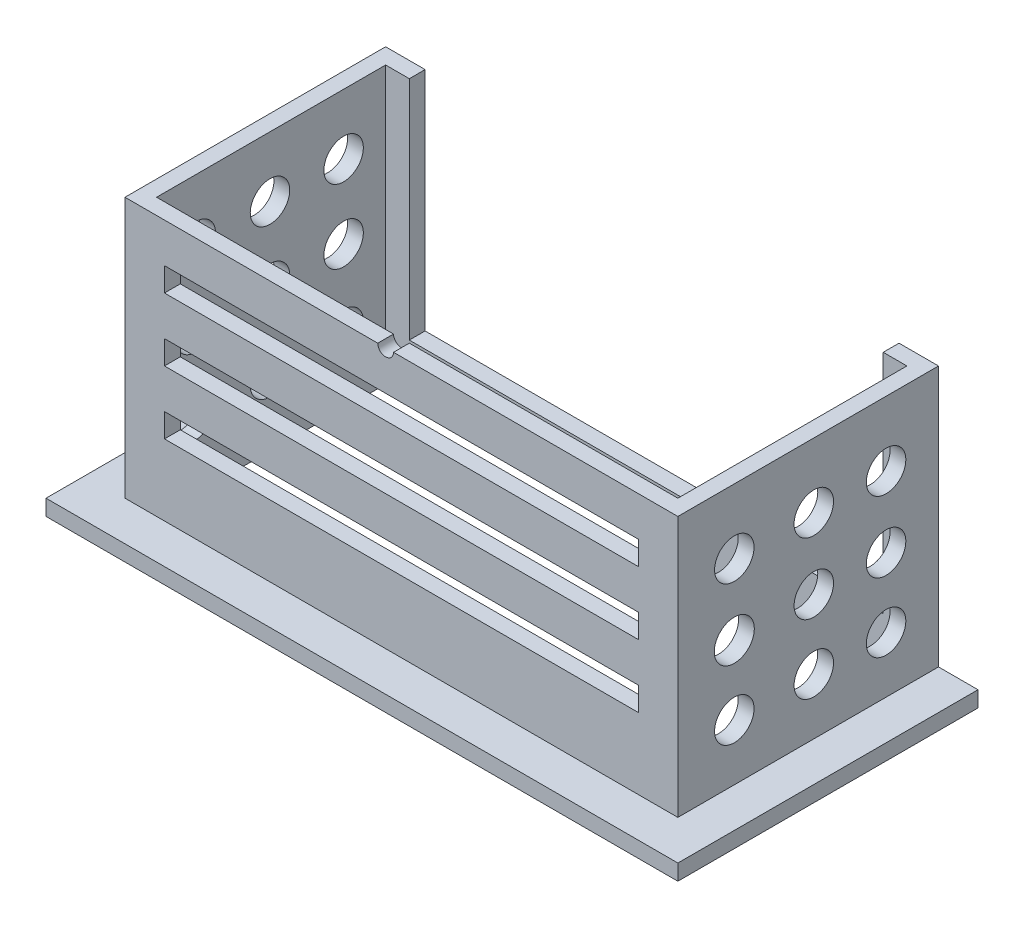
from build123d import *

# Parameters (mm, degrees)
SKETCH1_W           = 70
SKETCH1_H           = 33
BOSS_EXTRUDE1_DEPTH = 35
SKETCH2_W           = 33
SKETCH2_H           = 2
BOSS_EXTRUDE2_DEPTH = 5
SKETCH3_W           = 66
SKETCH3_H           = 29
CUT_EXTRUDE1_DEPTH  = 81.917773835
CUT_EXTRUDE3_DEPTH  = 5
SKETCH13_R          = 2.5
SKETCH13_R_2        = 2.535133393
CUT_EXTRUDE4_DEPTH  = 5
SKETCH14_W          = 33
SKETCH14_H          = 2
BOSS_EXTRUDE4_DEPTH = 5
SKETCH15_R          = 2.5
CUT_EXTRUDE5_DEPTH  = 5
SKETCH17_W          = 80
SKETCH17_H          = 2
BOSS_EXTRUDE6_DEPTH = 5
SKETCH19_W          = 60
SKETCH19_H          = 28.661725901
CUT_EXTRUDE6_DEPTH  = 5
SKETCH20_W          = 60
SKETCH20_H          = 3
CUT_EXTRUDE7_DEPTH  = 5
SKETCH21_W          = 60
SKETCH21_H          = 3
CUT_EXTRUDE8_DEPTH  = 5


with BuildPart() as part:
    # Sketch1 → Boss-Extrude1 (new body)
    with BuildSketch(Plane(origin=(0, 0, 0), x_dir=(1, 0, 0), z_dir=(0, 1, 0))):
        with Locations((-26.152195741, 23.288127357)):
            Rectangle(SKETCH1_W, SKETCH1_H)
    extrude(amount=BOSS_EXTRUDE1_DEPTH)

    # Sketch2 → Boss-Extrude2 (add)
    with BuildSketch(Plane(origin=(8.847804259, 0, 0), x_dir=(0, 0, -1), z_dir=(1, 0, 0))):
        with Locations((23.288127357, 1)):
            Rectangle(SKETCH2_W, SKETCH2_H)
    extrude(amount=BOSS_EXTRUDE2_DEPTH)

    # Sketch3 → Cut-Extrude1 (cut, through all)
    with BuildSketch(Plane(origin=(0, 35, 0), x_dir=(-1, 0, 0), z_dir=(0, 1, 0))):
        with Locations((26.152195741, -23.288127357)):
            Rectangle(SKETCH3_W, SKETCH3_H)
    extrude(amount=-CUT_EXTRUDE1_DEPTH, mode=Mode.SUBTRACT)

    # Sketch9 → Cut-Extrude3 (cut)
    with BuildSketch(Plane.XY.offset(-6.788127357)):
        with BuildLine():
            Line((-27.152195741, 35), (-28.152195741, 35))
            Line((-28.152195741, 35), (-29.152195741, 35))
            ThreePointArc((-29.152195741, 35), (-28.152195741, 34), (-27.152195741, 35))
        make_face()
    extrude(amount=-CUT_EXTRUDE3_DEPTH, mode=Mode.SUBTRACT)

    # Sketch13 → Cut-Extrude4 (cut)
    with BuildSketch(Plane(origin=(8.847804259, 0, 0), x_dir=(0, 0, -1), z_dir=(1, 0, 0))):
        with Locations((13.933834133, 9.111651729)):
            Circle(SKETCH13_R)
        with Locations((13.933834133, 17.855882351)):
            Circle(SKETCH13_R_2)
        with Locations((13.933834133, 26.803467174)):
            Circle(SKETCH13_R)
        with Locations((23.999867059, 26.803467174)):
            Circle(SKETCH13_R)
        with Locations((23.999867059, 17.855882351)):
            Circle(SKETCH13_R)
        with Locations((23.999867059, 9.111651729)):
            Circle(SKETCH13_R)
        with Locations((33.150806082, 9.111651729)):
            Circle(SKETCH13_R)
        with Locations((33.150806082, 17.855882351)):
            Circle(SKETCH13_R)
        with Locations((33.150806082, 26.803467174)):
            Circle(SKETCH13_R)
    extrude(amount=-CUT_EXTRUDE4_DEPTH, mode=Mode.SUBTRACT)

    # Sketch14 → Boss-Extrude4 (add)
    with BuildSketch(Plane.ZY.offset(61.152195741)):
        with Locations((-23.288127357, 1)):
            Rectangle(SKETCH14_W, SKETCH14_H)
    extrude(amount=BOSS_EXTRUDE4_DEPTH)

    # Sketch15 → Cut-Extrude5 (cut)
    with BuildSketch(Plane.ZY.offset(61.152195741)):
        with Locations((-32.467310019, 8.356134386)):
            Circle(SKETCH15_R)
        with Locations((-23.146909162, 8.426743484)):
            Circle(SKETCH15_R)
        with Locations((-13.755899208, 8.426743484)):
            Circle(SKETCH15_R)
        with Locations((-13.755899208, 18.029580731)):
            Circle(SKETCH15_R)
        with Locations((-23.146909162, 18.029580731)):
            Circle(SKETCH15_R)
        with Locations((-32.467310019, 18.029580731)):
            Circle(SKETCH15_R)
        with Locations((-32.467310019, 27.349981588)):
            Circle(SKETCH15_R)
        with Locations((-23.146909162, 27.349981588)):
            Circle(SKETCH15_R)
        with Locations((-13.755899208, 27.349981588)):
            Circle(SKETCH15_R)
    extrude(amount=-CUT_EXTRUDE5_DEPTH, mode=Mode.SUBTRACT)

    # Sketch17 → Boss-Extrude6 (add)
    with BuildSketch(Plane.XY.offset(-6.788127357)):
        with Locations((-26.152195741, 1)):
            Rectangle(SKETCH17_W, SKETCH17_H)
    extrude(amount=BOSS_EXTRUDE6_DEPTH)

    # Sketch19 → Cut-Extrude6 (cut)
    with BuildSketch(Plane(origin=(0, 0, -39.788127357), x_dir=(-1, 0, 0), z_dir=(0, 0, -1))):
        with Locations((26.152195741, 20.66913705)):
            Rectangle(SKETCH19_W, SKETCH19_H)
    extrude(amount=-CUT_EXTRUDE6_DEPTH, mode=Mode.SUBTRACT)

    # Sketch20 → Cut-Extrude7 (cut)
    with BuildSketch(Plane.XY.offset(-6.788127357)):
        with Locations((-26.152195741, 28.5)):
            Rectangle(SKETCH20_W, SKETCH20_H)
    extrude(amount=-CUT_EXTRUDE7_DEPTH, mode=Mode.SUBTRACT)

    # Sketch21 → Cut-Extrude8 (cut)
    with BuildSketch(Plane.XY.offset(-6.788127357)):
        with Locations((-26.152195741, 12.5)):
            Rectangle(SKETCH21_W, SKETCH21_H)
        with Locations((-26.152195741, 20.5)):
            Rectangle(SKETCH21_W, SKETCH21_H)
    extrude(amount=-CUT_EXTRUDE8_DEPTH, mode=Mode.SUBTRACT)


solid = part.part
